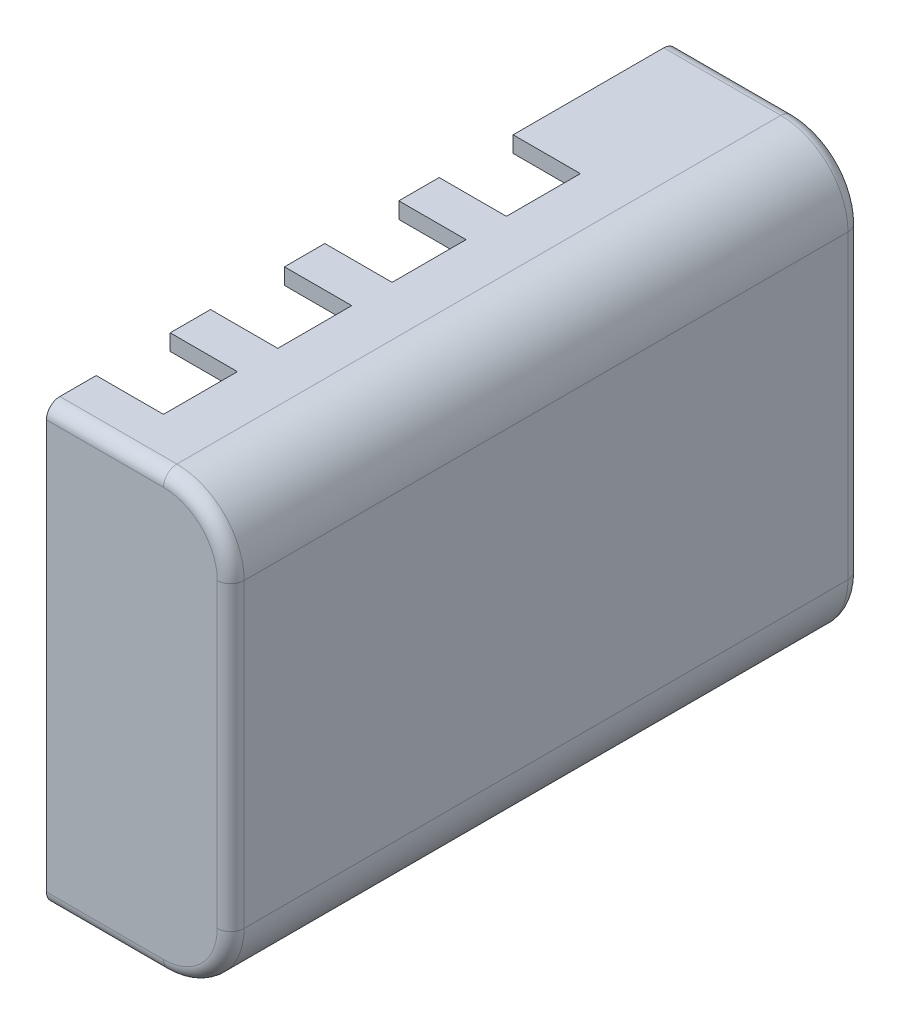
from build123d import *

# Parameters (mm, degrees)
SKETCH1_W           = 44.5
SKETCH1_H           = 30
BOSS_EXTRUDE1_DEPTH = 12.5
SHELL2_T            = 1.2
SKETCH2_W           = 5
SKETCH2_H           = 5.5
CUT_EXTRUDE1_DEPTH  = 1.2
SKETCH3_W           = 4.2
SKETCH3_H           = 5
CUT_EXTRUDE2_DEPTH  = 1.2
FILLET1_R           = 5
FILLET3_R           = 1


with BuildPart() as part:
    # Sketch1 → Boss-Extrude1 (new body)
    with BuildSketch(Plane(origin=(0, 0, 0), x_dir=(0, 0, -1), z_dir=(1, 0, 0))):
        Rectangle(SKETCH1_W, SKETCH1_H)
    extrude(amount=BOSS_EXTRUDE1_DEPTH)

    # Shell2
    shell2_openings = [part.faces().sort_by_distance(p)[0] for p in [
        (0, 0, 0),
    ]]
    offset(amount=SHELL2_T, openings=shell2_openings, kind=Kind.INTERSECTION)

    # Sketch2 → Cut-Extrude1 (cut)
    with BuildSketch(Plane.XZ.offset(-15)):
        with Locations((2.5, 17)):
            Rectangle(SKETCH2_W, SKETCH2_H)
        with Locations((2.5, 8.5)):
            Rectangle(SKETCH2_W, SKETCH2_H)
        with Locations((2.5, 0)):
            Rectangle(SKETCH2_W, SKETCH2_H)
        with Locations((2.5, -8.5)):
            Rectangle(SKETCH2_W, SKETCH2_H)
    extrude(amount=-CUT_EXTRUDE1_DEPTH, mode=Mode.SUBTRACT)

    # Sketch3 → Cut-Extrude2 (cut)
    with BuildSketch(Plane(origin=(0, 0, -23.45), x_dir=(-1, 0, 0), z_dir=(0, 0, -1))):
        with BuildLine():
            Line((0, 3), (-1.95, 3))
            ThreePointArc((-1.95, 3), (-4.2, 0.75), (-1.95, -1.5))
            Line((-1.95, -1.5), (0, -1.5))
            Line((0, -1.5), (0, 3))
        make_face()
        with Locations((-2.1, 9.5)):
            Rectangle(SKETCH3_W, SKETCH3_H)
    extrude(amount=-CUT_EXTRUDE2_DEPTH, mode=Mode.SUBTRACT)

    # Fillet1
    fillet1_edges = [part.edges().sort_by_distance(p)[0] for p in [
        (13.7, -16.2, 0),
        (12.5, 15, 0),
        (12.5, -15, 0),
        (13.7, 16.2, 0),
    ]]
    fillet(fillet1_edges, radius=FILLET1_R)

    # Fillet3
    fillet3_edges = [part.edges().sort_by_distance(p)[0] for p in [
        (13.7, 0, -23.45),
        (13.7, 0, 23.45),
        (4.35, 16.2, -23.45),
        (4.35, -16.2, -23.45),
        (12.235533906, 14.735533906, -23.45),
        (12.235533906, -14.735533906, -23.45),
        (4.35, -16.2, 23.45),
        (4.35, 16.2, 23.45),
        (12.235533906, 14.735533906, 23.45),
        (12.235533906, -14.735533906, 23.45),
    ]]
    fillet(fillet3_edges, radius=FILLET3_R)


solid = part.part
